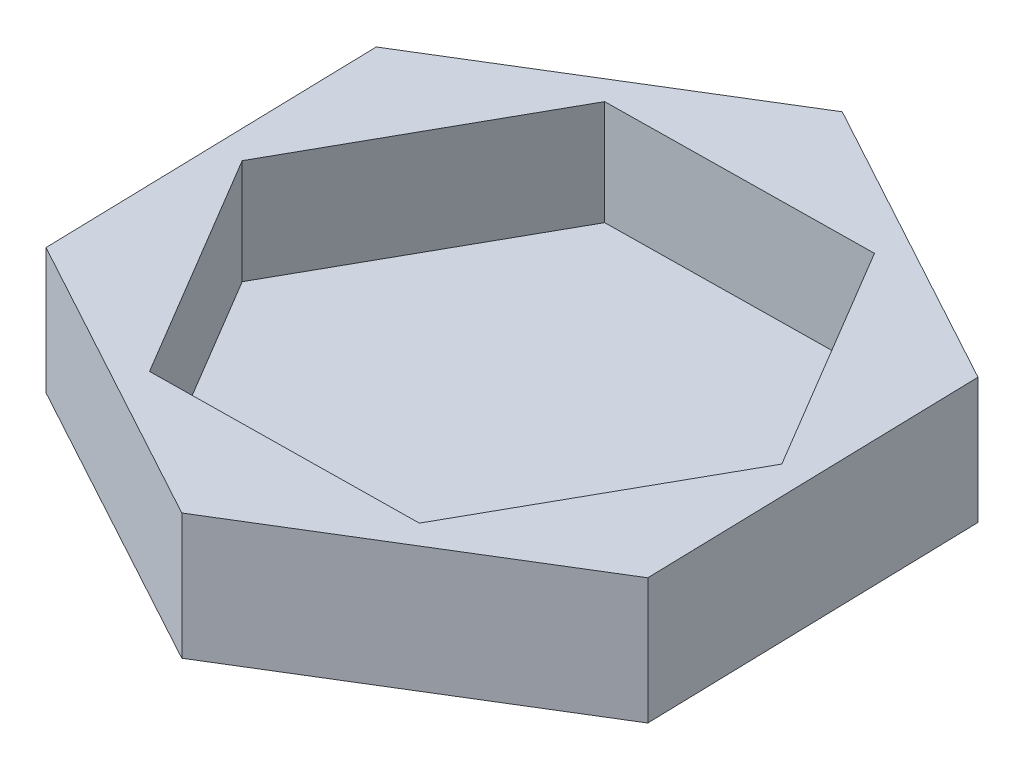
from build123d import *

# Parameters (mm, degrees)
BOSS_EXTRUDE1_DEPTH = 30
CUT_EXTRUDE1_DEPTH  = 25


with BuildPart() as part:
    # Sketch2 → Boss-Extrude1 (new body)
    with BuildSketch(Plane(origin=(0, 0, 0), x_dir=(1, 0, 0), z_dir=(0, 1, 0))):
        Polygon((-71.004000985, 38.623376049), (-68.950825331, -42.179580599), (2.053175654, -80.802956648), (71.004000985, -38.623376049), (68.950825331, 42.179580599), (-2.053175654, 80.802956648), align=None)
    extrude(amount=BOSS_EXTRUDE1_DEPTH)

    # Sketch3 → Cut-Extrude1 (cut)
    with BuildSketch(Plane(origin=(0, 30, 0), x_dir=(1, 0, 0), z_dir=(0, 1, 0))):
        Polygon((-32.478654732, 54.575363674), (-63.502978728, -0.839658241), (-31.024323997, -55.415021915), (32.478654732, -54.575363674), (63.502978728, 0.839658241), (31.024323997, 55.415021915), align=None)
    extrude(amount=-CUT_EXTRUDE1_DEPTH, mode=Mode.SUBTRACT)


solid = part.part
